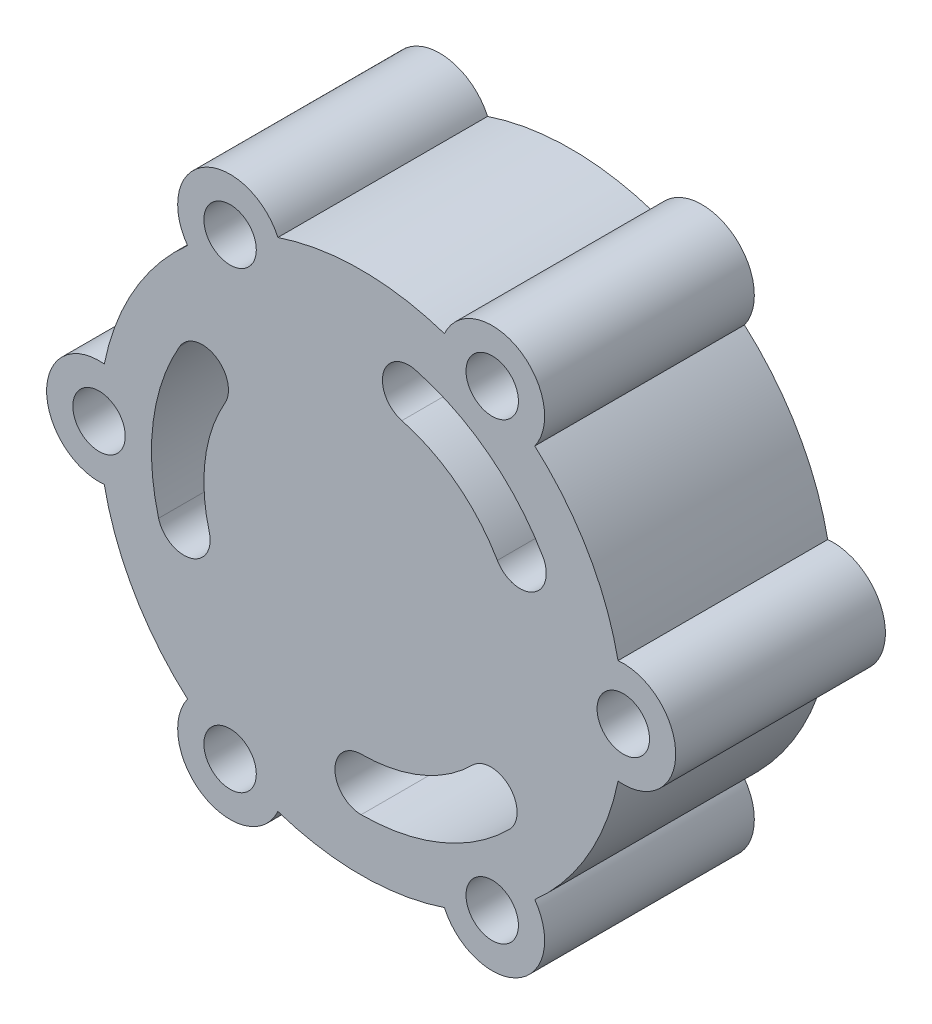
from build123d import *

# Parameters (mm, degrees)
SKETCH1_R           = 5
BOSS_EXTRUDE1_DEPTH = 40


with BuildPart() as part:
    # Sketch1 → Boss-Extrude1 (new body)
    with BuildSketch(Plane.XY):
        with BuildLine():
            ThreePointArc((119, 60.050125629), (130, 70), (119, 79.949874371))
            ThreePointArc((119, 79.949874371), (113.301270189, 95), (103.11684397, 107.4603076))
            ThreePointArc((103.11684397, 107.4603076), (100, 121.961524227), (85.88315603, 117.410181971))
            ThreePointArc((85.88315603, 117.410181971), (70, 120), (54.11684397, 117.410181971))
            ThreePointArc((54.11684397, 117.410181971), (40, 121.961524227), (36.88315603, 107.4603076))
            ThreePointArc((36.88315603, 107.4603076), (26.698729811, 95), (21, 79.949874371))
            ThreePointArc((21, 79.949874371), (10, 70), (21, 60.050125629))
            ThreePointArc((21, 60.050125629), (26.698729811, 45), (36.88315603, 32.5396924))
            ThreePointArc((36.88315603, 32.5396924), (40, 18.038475773), (54.11684397, 22.589818029))
            ThreePointArc((54.11684397, 22.589818029), (70, 20), (85.88315603, 22.589818029))
            ThreePointArc((85.88315603, 22.589818029), (100, 18.038475773), (103.11684397, 32.5396924))
            ThreePointArc((103.11684397, 32.5396924), (113.301270189, 45), (119, 60.050125629))
        make_face()
        with Locations((120, 70)):
            Circle(SKETCH1_R, mode=Mode.SUBTRACT)
        with Locations((95, 26.698729811)):
            Circle(SKETCH1_R, mode=Mode.SUBTRACT)
        with Locations((45, 26.698729811)):
            Circle(SKETCH1_R, mode=Mode.SUBTRACT)
        with Locations((20, 70)):
            Circle(SKETCH1_R, mode=Mode.SUBTRACT)
        with Locations((45, 113.301270189)):
            Circle(SKETCH1_R, mode=Mode.SUBTRACT)
        with Locations((95, 113.301270189)):
            Circle(SKETCH1_R, mode=Mode.SUBTRACT)
        with BuildLine():
            ThreePointArc((104.641016151, 90), (94.35045716, 101.734133612), (80.352761804, 108.637033052))
            ThreePointArc((80.352761804, 108.637033052), (74.229037447, 105.101499146), (77.764571353, 98.977774789))
            ThreePointArc((77.764571353, 98.977774789), (88.26284287, 93.800600209), (95.980762114, 85))
            ThreePointArc((95.980762114, 85), (102.810889132, 83.169872981), (104.641016151, 90))
        make_face(mode=Mode.SUBTRACT)
        with BuildLine():
            ThreePointArc((70, 30), (85.307337295, 33.0448187), (98.284271247, 41.715728753))
            ThreePointArc((98.284271247, 41.715728753), (98.284271247, 48.786796564), (91.213203436, 48.786796564))
            ThreePointArc((91.213203436, 48.786796564), (81.480502971, 42.283614025), (70, 40))
            ThreePointArc((70, 40), (65, 35), (70, 30))
        make_face(mode=Mode.SUBTRACT)
        with BuildLine():
            ThreePointArc((35.358983849, 90), (30.342205545, 75.221047689), (31.362966948, 59.647238196))
            ThreePointArc((31.362966948, 59.647238196), (37.486691305, 56.11170429), (41.022225211, 62.235428647))
            ThreePointArc((41.022225211, 62.235428647), (40.256654159, 73.915785767), (44.019237886, 85))
            ThreePointArc((44.019237886, 85), (42.189110868, 91.830127019), (35.358983849, 90))
        make_face(mode=Mode.SUBTRACT)
    extrude(amount=BOSS_EXTRUDE1_DEPTH)


solid = part.part
